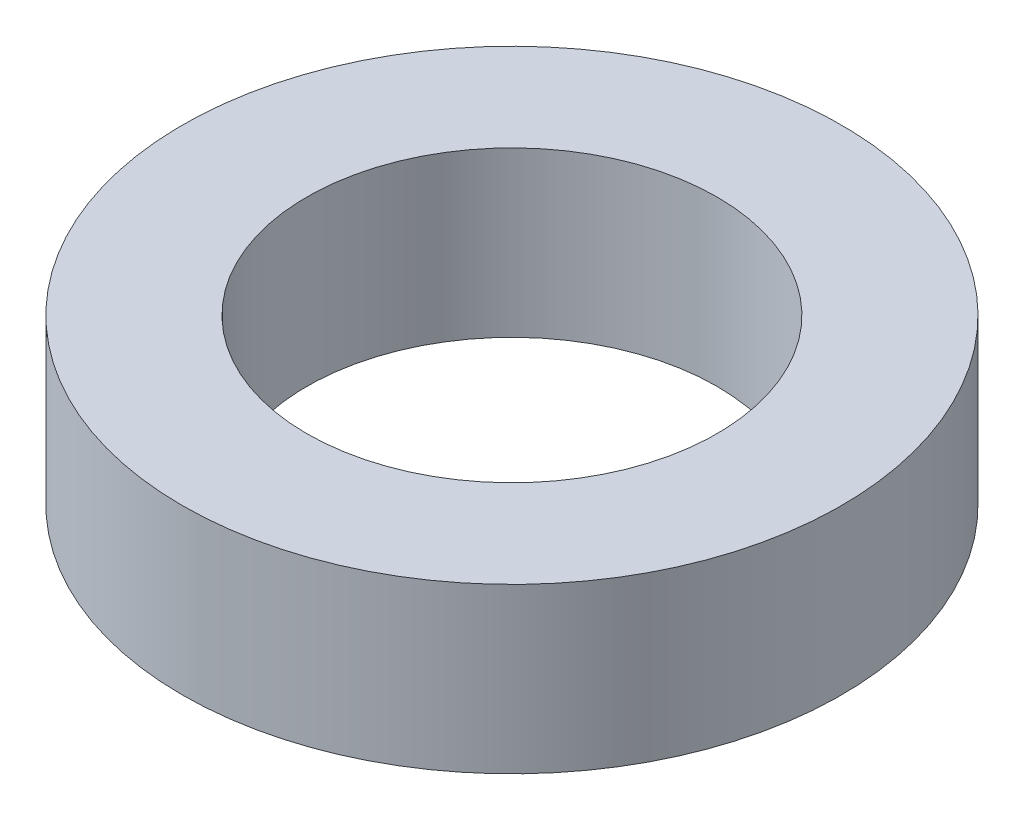
from build123d import *

# Parameters (mm, degrees)
SKETCH_1_R      = 22.5
SKETCH_1_R_2    = 14
EXTRUDE_1_DEPTH = 11.2


with BuildPart() as part:
    # 草图1 → 凸台-拉伸1 (new body)
    with BuildSketch(Plane(origin=(0, 0, 0), x_dir=(1, 0, 0), z_dir=(0, 1, 0))):
        with Locations(Location((0, 0, 0), (0, 0, 270))):
            Circle(SKETCH_1_R)
        with Locations(Location((0, 0, 0), (0, 0, 270))):
            Circle(SKETCH_1_R_2, mode=Mode.SUBTRACT)
    extrude(amount=EXTRUDE_1_DEPTH)


solid = part.part
